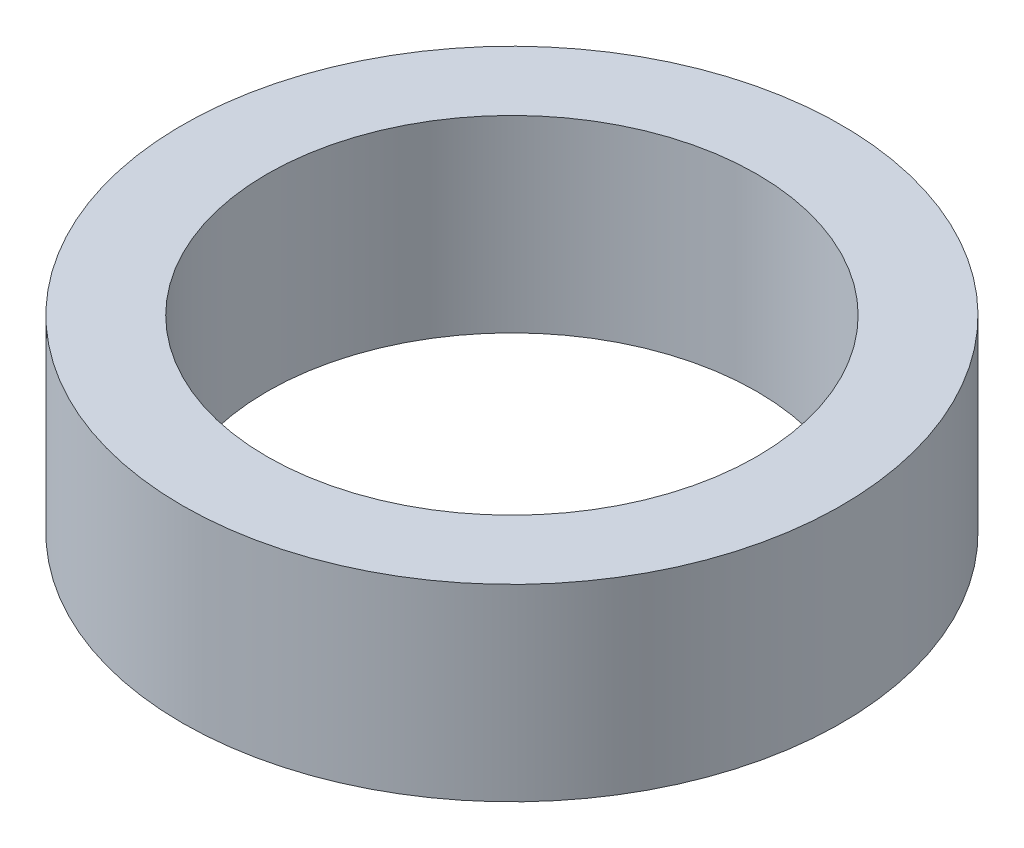
from build123d import *

# Parameters (mm, degrees)
SKETCH1_R           = 3.5
SKETCH1_R_2         = 2.6
BOSS_EXTRUDE1_DEPTH = 2


with BuildPart() as part:
    # Sketch1 → Boss-Extrude1 (new body)
    with BuildSketch(Plane(origin=(0, 0, 0), x_dir=(1, 0, 0), z_dir=(0, 1, 0))):
        with Locations(Location((0, 0, 0), (0, 0, 270))):
            Circle(SKETCH1_R)
        with Locations(Location((0, 0, 0), (0, 0, 270))):
            Circle(SKETCH1_R_2, mode=Mode.SUBTRACT)
    extrude(amount=BOSS_EXTRUDE1_DEPTH)


solid = part.part
